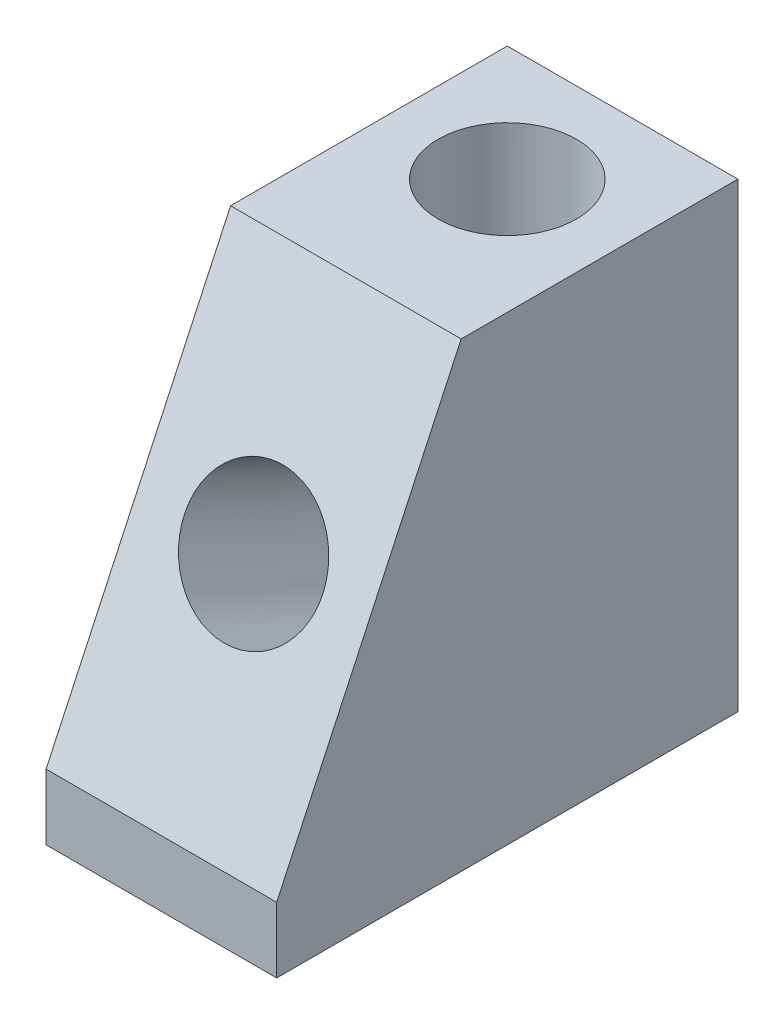
from build123d import *

# Parameters (mm, degrees)
SKETCH_1_W          = 5
SKETCH_1_H          = 10
SKETCH_1_R          = 1.5
EXTRUDE_1_DEPTH     = 10
CUT_EXTRUDE_1_DEPTH = 5
SKETCH_3_R          = 1.5
CUT_EXTRUDE_2_DEPTH = 16.204427687


with BuildPart() as part:
    # 草图1 → 凸台-拉伸1 (new body)
    with BuildSketch(Plane(origin=(0, 0, 0), x_dir=(1, 0, 0), z_dir=(0, 1, 0))):
        with Locations((2.5, 5)):
            Rectangle(SKETCH_1_W, SKETCH_1_H)
        with Locations(Location((2.5, 7.5, 0), (0, 0, 270))):
            Circle(SKETCH_1_R, mode=Mode.SUBTRACT)
    extrude(amount=EXTRUDE_1_DEPTH)

    # 草图2 → 切除-拉伸1 (cut)
    with BuildSketch(Plane(origin=(5, 0, 0), x_dir=(0, 0, -1), z_dir=(1, 0, 0))):
        Polygon((0, 1.421972318), (4, 10), (0, 10), align=None)
    extrude(amount=-CUT_EXTRUDE_1_DEPTH, mode=Mode.SUBTRACT)

    # 草图3 → 切除-拉伸2 (cut, through all)
    with BuildSketch(Plane(origin=(0, 0.253973065, 0.544646996), x_dir=(1, 0, 0), z_dir=(0, 0.4226182617406972, 0.9063077870366509))):
        with Locations(Location((2.5, 6.021147751, 0), (0, 0, 270))):
            Circle(SKETCH_3_R)
    extrude(amount=-CUT_EXTRUDE_2_DEPTH, mode=Mode.SUBTRACT)


solid = part.part
